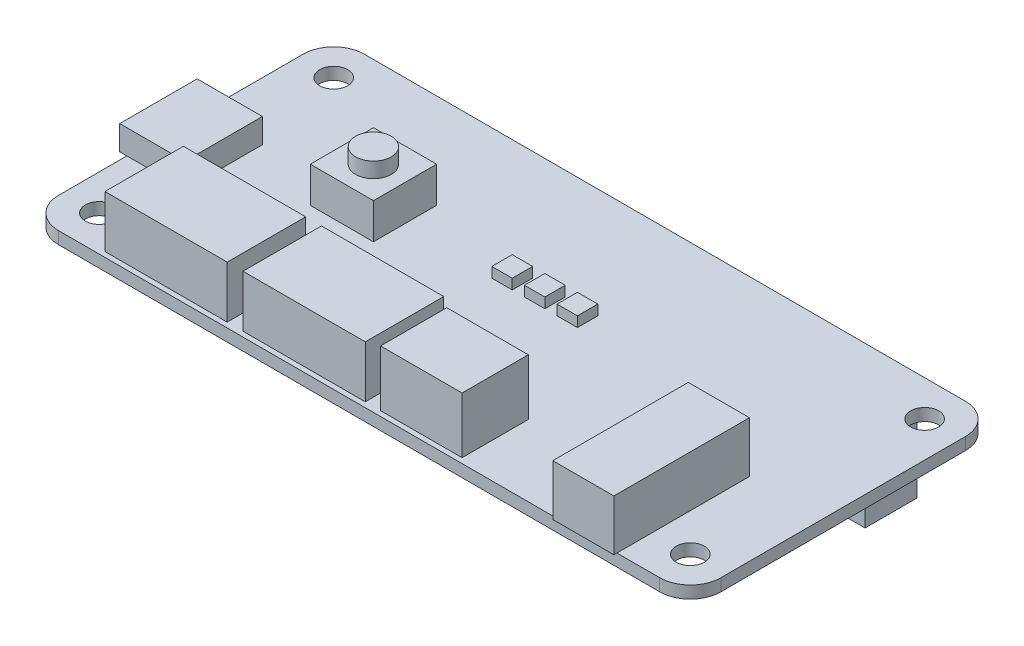
from build123d import *

# Parameters (mm, degrees)
EXTRUDE_1_DEPTH     = 1.2
SKETCH_2_R          = 1.375
CUT_EXTRUDE_1_DEPTH = 1.2
SKETCH_3_W          = 6
SKETCH_3_H          = 13
EXTRUDE_2_DEPTH     = 5
SKETCH_4_W          = 6
SKETCH_4_H          = 5
EXTRUDE_3_DEPTH     = 0.3
SKETCH_5_W          = 8
SKETCH_5_H          = 7
EXTRUDE_4_DEPTH     = 5.5
SKETCH_6_W          = 12
SKETCH_6_H          = 8.2
EXTRUDE_5_DEPTH     = 5.1
SKETCH_7_W          = 12
SKETCH_7_H          = 8.2
EXTRUDE_6_DEPTH     = 5.1
SKETCH_8_W          = 5.7
SKETCH_8_H          = 7.6
EXTRUDE_7_DEPTH     = 2.4
SKETCH_9_W          = 7.6
SKETCH_9_H          = 2.4
EXTRUDE_8_DEPTH     = 0.7
SKETCH_10_W         = 12
SKETCH_10_H         = 5.1
SKETCH_10_W_2       = 8
SKETCH_10_H_2       = 5.5
CUT_EXTRUDE_2_DEPTH = 0.5
SKETCH_11_W         = 51.4
SKETCH_11_H         = 5.1
EXTRUDE_9_DEPTH     = 8.5
SKETCH_12_W         = 6.2
SKETCH_12_H         = 6.2
EXTRUDE_10_DEPTH    = 3.5
SKETCH_13_R         = 1.75
EXTRUDE_11_DEPTH    = 1.5
SKETCH_14_W         = 2
SKETCH_14_H         = 2
EXTRUDE_12_DEPTH    = 1


with BuildPart() as part:
    # 草图1 → 凸台-拉伸1 (new body)
    with BuildSketch(Plane(origin=(0, 0, 0), x_dir=(1, 0, 0), z_dir=(0, 1, 0))):
        with BuildLine():
            Line((-29.5, 15), (29.5, 15))
            ThreePointArc((29.5, 15), (31.621320344, 14.121320344), (32.5, 12))
            Line((32.5, 12), (32.5, -12))
            ThreePointArc((32.5, -12), (31.621320344, -14.121320344), (29.5, -15))
            Line((29.5, -15), (-29.5, -15))
            ThreePointArc((-29.5, -15), (-31.621320344, -14.121320344), (-32.5, -12))
            Line((-32.5, -12), (-32.5, 12))
            ThreePointArc((-32.5, 12), (-31.621320344, 14.121320344), (-29.5, 15))
        make_face()
    extrude(amount=EXTRUDE_1_DEPTH)

    # 草图2 → 切除-拉伸1 (cut)
    with BuildSketch(Plane(origin=(0, 1.2, 0), x_dir=(1, 0, 0), z_dir=(0, 1, 0))):
        with Locations(Location((29, -11.5, 0), (0, 0, 270))):
            Circle(SKETCH_2_R)
        with Locations(Location((29, 11.5, 0), (0, 0, 270))):
            Circle(SKETCH_2_R)
        with Locations(Location((-29, -11.5, 0), (0, 0, 270))):
            Circle(SKETCH_2_R)
        with Locations(Location((-29, 11.5, 0), (0, 0, 270))):
            Circle(SKETCH_2_R)
    extrude(amount=-CUT_EXTRUDE_1_DEPTH, mode=Mode.SUBTRACT)

    # 草图3 → 凸台-拉伸2 (add)
    with BuildSketch(Plane(origin=(0, 1.2, 0), x_dir=(1, 0, 0), z_dir=(0, 1, 0))):
        with Locations((22.3, -8.5)):
            Rectangle(SKETCH_3_W, SKETCH_3_H)
    extrude(amount=EXTRUDE_2_DEPTH)

    # 草图4 → 凸台-拉伸3 (add)
    with BuildSketch(Plane.XY.offset(15)):
        with Locations((22.3, 3.7)):
            Rectangle(SKETCH_4_W, SKETCH_4_H)
    extrude(amount=EXTRUDE_3_DEPTH)

    # 草图5 → 凸台-拉伸4 (add)
    with BuildSketch(Plane(origin=(0, 1.2, 0), x_dir=(1, 0, 0), z_dir=(0, 1, 0))):
        with Locations((5.6, -11.5)):
            Rectangle(SKETCH_5_W, SKETCH_5_H)
    extrude(amount=EXTRUDE_4_DEPTH)

    # 草图6 → 凸台-拉伸5 (add)
    with BuildSketch(Plane(origin=(0, 1.2, 0), x_dir=(1, 0, 0), z_dir=(0, 1, 0))):
        with Locations((-5.9, -10.9)):
            Rectangle(SKETCH_6_W, SKETCH_6_H)
    extrude(amount=EXTRUDE_5_DEPTH)

    # 草图7 → 凸台-拉伸6 (add)
    with BuildSketch(Plane(origin=(0, 1.2, 0), x_dir=(1, 0, 0), z_dir=(0, 1, 0))):
        with Locations((-19.45, -10.9)):
            Rectangle(SKETCH_7_W, SKETCH_7_H)
    extrude(amount=EXTRUDE_6_DEPTH)

    # 草图8 → 凸台-拉伸7 (add)
    with BuildSketch(Plane(origin=(0, 1.2, 0), x_dir=(1, 0, 0), z_dir=(0, 1, 0))):
        with Locations((-29.65, -1.5)):
            Rectangle(SKETCH_8_W, SKETCH_8_H)
    extrude(amount=EXTRUDE_7_DEPTH)

    # 草图9 → 凸台-拉伸8 (add)
    with BuildSketch(Plane.ZY.offset(32.5)):
        with Locations((1.5, 2.4)):
            Rectangle(SKETCH_9_W, SKETCH_9_H)
    extrude(amount=EXTRUDE_8_DEPTH)

    # 草图10 → 切除-拉伸2 (cut)
    with BuildSketch(Plane.XY.offset(15)):
        with Locations((-19.45, 3.75)):
            Rectangle(SKETCH_10_W, SKETCH_10_H)
        with Locations((-5.9, 3.75)):
            Rectangle(SKETCH_10_W, SKETCH_10_H)
        with Locations((5.6, 3.95)):
            Rectangle(SKETCH_10_W_2, SKETCH_10_H_2)
    extrude(amount=-CUT_EXTRUDE_2_DEPTH, mode=Mode.SUBTRACT)

    # 草图11 → 凸台-拉伸9 (add)
    with BuildSketch(Plane.XZ):
        with Locations((-0.05, -11.55)):
            Rectangle(SKETCH_11_W, SKETCH_11_H)
    extrude(amount=EXTRUDE_9_DEPTH)

    # 草图12 → 凸台-拉伸10 (add)
    with BuildSketch(Plane(origin=(0, 1.2, 0), x_dir=(1, 0, 0), z_dir=(0, 1, 0))):
        with Locations((-16.2, 2.6)):
            Rectangle(SKETCH_12_W, SKETCH_12_H)
    extrude(amount=EXTRUDE_10_DEPTH)

    # 草图13 → 凸台-拉伸11 (add)
    with BuildSketch(Plane(origin=(0, 4.7, 0), x_dir=(1, 0, 0), z_dir=(0, 1, 0))):
        with Locations(Location((-16.2, 2.6, 0), (0, 0, 270))):
            Circle(SKETCH_13_R)
    extrude(amount=EXTRUDE_11_DEPTH)

    # 草图14 → 凸台-拉伸12 (add)
    with BuildSketch(Plane(origin=(0, 1.2, 0), x_dir=(1, 0, 0), z_dir=(0, 1, 0))):
        with Locations((3.2, 3.22)):
            Rectangle(SKETCH_14_W, SKETCH_14_H)
        with Locations((0, 3.22)):
            Rectangle(SKETCH_14_W, SKETCH_14_H)
        with Locations((-3.2, 3.22)):
            Rectangle(SKETCH_14_W, SKETCH_14_H)
    extrude(amount=EXTRUDE_12_DEPTH)


solid = part.part
